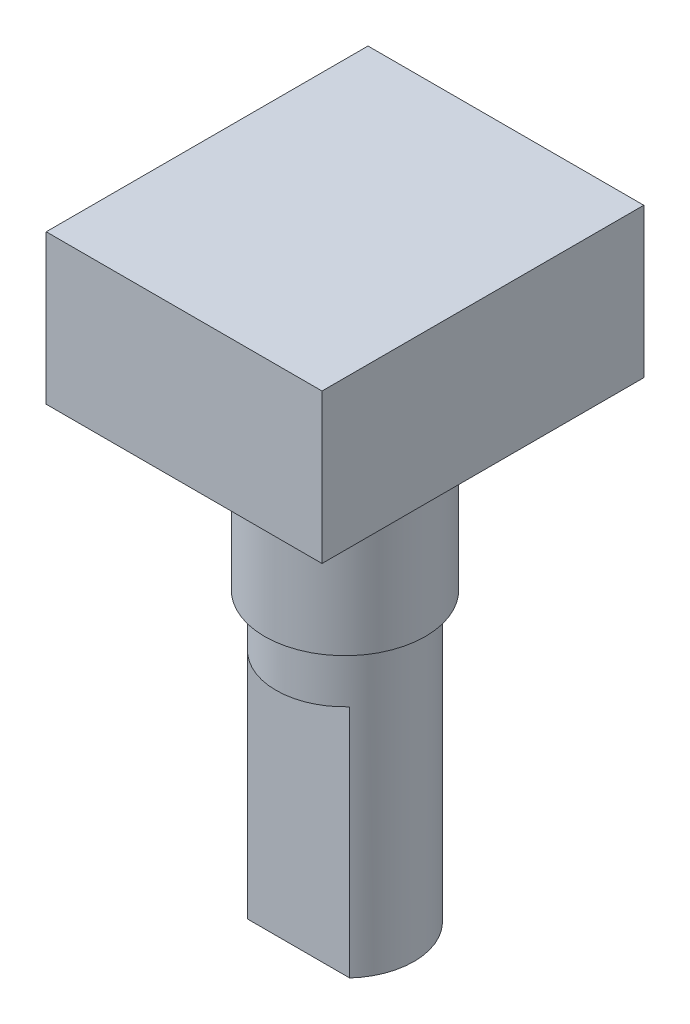
from build123d import *

# Parameters (mm, degrees)
SKETCH1_W           = 12
SKETCH1_H           = 14
BOSS_EXTRUDE1_DEPTH = 6.5
SKETCH2_R           = 3.5
BOSS_EXTRUDE2_DEPTH = 7.5
SKETCH3_R           = 3
BOSS_EXTRUDE3_DEPTH = 12.5
CUT_EXTRUDE1_START  = -10.22
CUT_EXTRUDE1_DEPTH  = 10.22


with BuildPart() as part:
    # Sketch1 → Boss-Extrude1 (new body)
    with BuildSketch(Plane(origin=(0, 0, 0), x_dir=(1, 0, 0), z_dir=(0, 1, 0))):
        Rectangle(SKETCH1_W, SKETCH1_H)
    extrude(amount=BOSS_EXTRUDE1_DEPTH)

    # Sketch2 → Boss-Extrude2 (add)
    with BuildSketch(Plane.XZ):
        with Locations(Location((0, 0, 0), (0, 0, 90))):
            Circle(SKETCH2_R)
    extrude(amount=BOSS_EXTRUDE2_DEPTH)

    # Sketch3 → Boss-Extrude3 (add)
    with BuildSketch(Plane.XZ.offset(7.5)):
        with Locations(Location((0, 0, 0), (0, 0, 270))):
            Circle(SKETCH3_R)
    extrude(amount=BOSS_EXTRUDE3_DEPTH)

    # Sketch4 → Cut-Extrude1 (cut)
    with BuildSketch(Plane.XZ.offset(20).offset(CUT_EXTRUDE1_START)):
        with BuildLine():
            Line((-2.86, 2.017523234), (2.86, 2.017523234))
            ThreePointArc((2.86, 2.017523234), (0, 3.5), (-2.86, 2.017523234))
        make_face()
    extrude(amount=CUT_EXTRUDE1_DEPTH, mode=Mode.SUBTRACT)


solid = part.part
